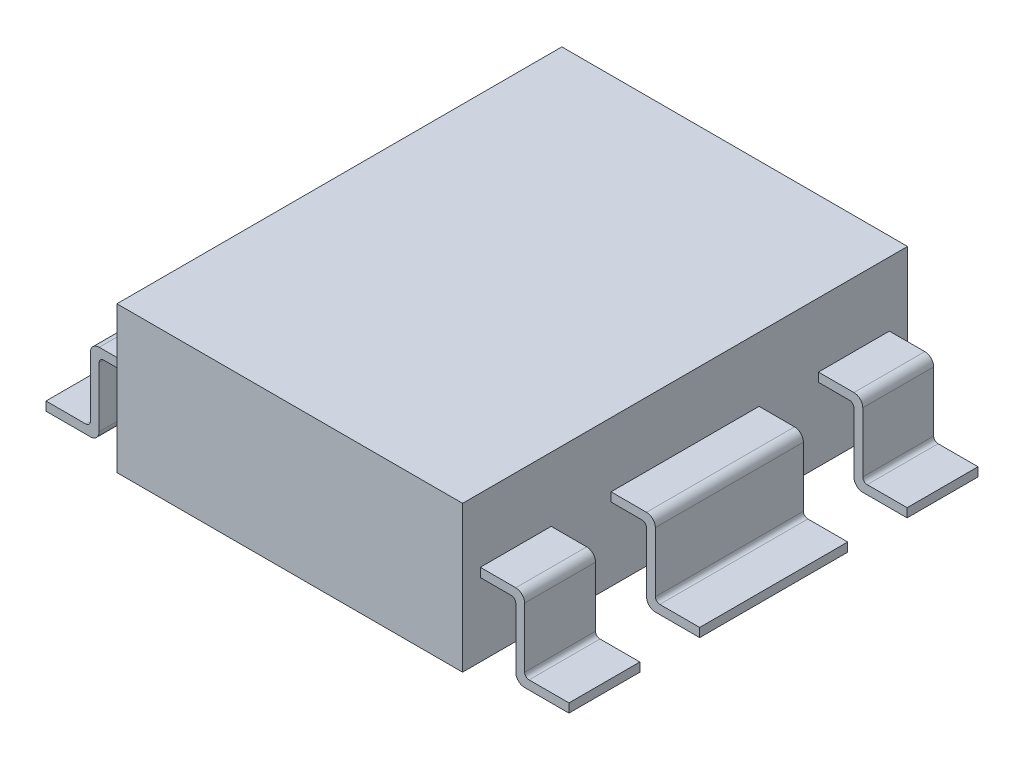
from build123d import *

# Parameters (mm, degrees)
SKETCH1_W           = 3.9
SKETCH1_H           = 5.02
BOSS_EXTRUDE1_DEPTH = 1.65
BOSS_EXTRUDE2_DEPTH = 5.02
SKETCH3_W           = 1
SKETCH3_H           = 0.205
SKETCH3_H_2         = 0.67
SKETCH3_H_3         = 0.675
SKETCH3_H_4         = 0.2
CUT_EXTRUDE1_DEPTH  = 5.210118763


with BuildPart() as part:
    # Sketch1 → Boss-Extrude1 (new body)
    with BuildSketch(Plane(origin=(0, 0, 0), x_dir=(1, 0, 0), z_dir=(0, 1, 0))):
        Rectangle(SKETCH1_W, SKETCH1_H)
    extrude(amount=BOSS_EXTRUDE1_DEPTH)

    # Sketch2 → Boss-Extrude2 (add)
    with BuildSketch(Plane.XY.offset(2.51)):
        with BuildLine():
            Line((2.95, 0), (2.45, 0))
            ThreePointArc((2.45, 0), (2.379289322, 0.029289322), (2.35, 0.1))
            Line((2.35, 0.1), (2.35, 0.775))
            ThreePointArc((2.35, 0.775), (2.335355339, 0.810355339), (2.3, 0.825))
            Line((2.3, 0.825), (1.95, 0.825))
            Line((1.95, 0.825), (1.95, 0.925))
            Line((1.95, 0.925), (2.35, 0.925))
            ThreePointArc((2.35, 0.925), (2.420710678, 0.895710678), (2.45, 0.825))
            Line((2.45, 0.825), (2.45, 0.15))
            ThreePointArc((2.45, 0.15), (2.464644661, 0.114644661), (2.5, 0.1))
            Line((2.5, 0.1), (2.95, 0.1))
            Line((2.95, 0.1), (2.95, 0))
        make_face()
        with BuildLine():
            Line((-1.95, 0.925), (-1.95, 0.825))
            Line((-1.95, 0.825), (-2.3, 0.825))
            ThreePointArc((-2.3, 0.825), (-2.335355339, 0.810355339), (-2.35, 0.775))
            Line((-2.35, 0.775), (-2.35, 0.1))
            ThreePointArc((-2.35, 0.1), (-2.379289322, 0.029289322), (-2.45, 0))
            Line((-2.45, 0), (-2.95, 0))
            Line((-2.95, 0), (-2.95, 0.1))
            Line((-2.95, 0.1), (-2.5, 0.1))
            ThreePointArc((-2.5, 0.1), (-2.464644661, 0.114644661), (-2.45, 0.15))
            Line((-2.45, 0.15), (-2.45, 0.825))
            ThreePointArc((-2.45, 0.825), (-2.420710678, 0.895710678), (-2.35, 0.925))
            Line((-2.35, 0.925), (-1.95, 0.925))
        make_face()
    extrude(amount=-BOSS_EXTRUDE2_DEPTH)

    # Sketch3 → Cut-Extrude1 (cut, through all)
    with BuildSketch(Plane(origin=(0, 1.65, 0), x_dir=(1, 0, 0), z_dir=(0, 1, 0))):
        with Locations((-2.45, 2.4075)):
            Rectangle(SKETCH3_W, SKETCH3_H)
        with Locations((2.45, 2.4075)):
            Rectangle(SKETCH3_W, SKETCH3_H)
        with Locations((-2.45, 1.17)):
            Rectangle(SKETCH3_W, SKETCH3_H_2)
        with Locations((2.45, 1.17)):
            Rectangle(SKETCH3_W, SKETCH3_H_2)
        with Locations((-2.45, -1.1725)):
            Rectangle(SKETCH3_W, SKETCH3_H_3)
        with Locations((2.45, -1.1725)):
            Rectangle(SKETCH3_W, SKETCH3_H_3)
        with Locations((2.45, -2.41)):
            Rectangle(SKETCH3_W, SKETCH3_H_4)
        with Locations((-2.45, -2.41)):
            Rectangle(SKETCH3_W, SKETCH3_H_4)
    extrude(amount=-CUT_EXTRUDE1_DEPTH, mode=Mode.SUBTRACT)


solid = part.part
